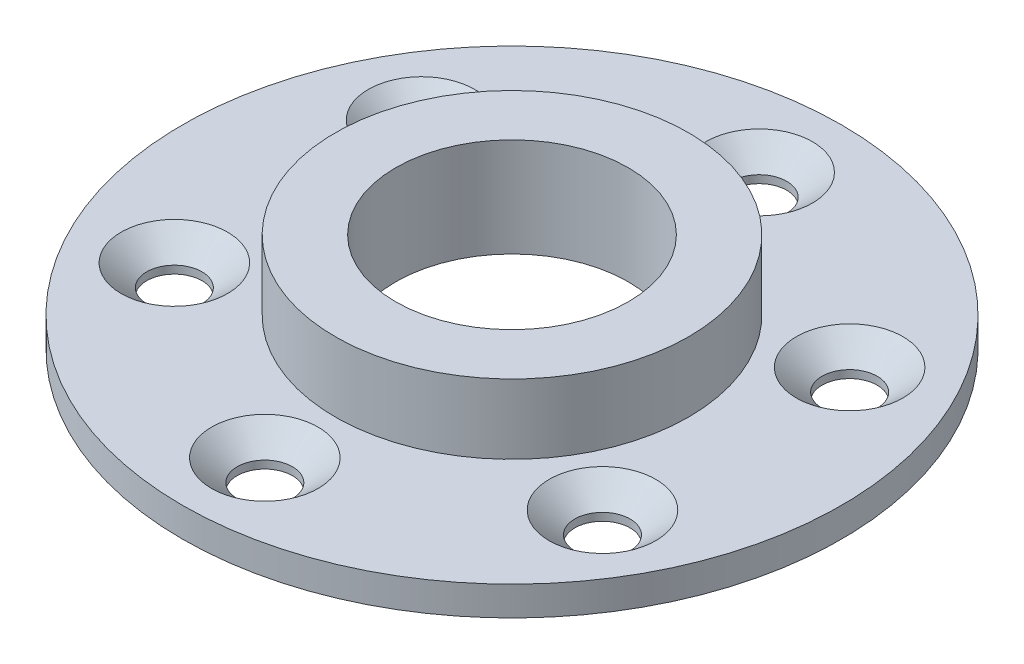
from build123d import *

# Parameters (mm, degrees)
SKETCH5_R           = 90
BOSS_EXTRUDE1_DEPTH = 8
SKETCH6_R           = 48.25
SKETCH6_R_2         = 31.75
EXTRUDE_THIN1_DEPTH = 19
CIRPATTERN1_COUNT   = 6
SKETCH13_W          = 31.75
SKETCH13_H          = 30.969260742


with BuildPart() as part:
    # Sketch5 → Boss-Extrude1 (new body)
    with BuildSketch(Plane(origin=(0, 0, 0), x_dir=(1, 0, 0), z_dir=(0, 1, 0))):
        with Locations(Location((0, 0, 0), (0, 0, 270))):
            Circle(SKETCH5_R)
    extrude(amount=BOSS_EXTRUDE1_DEPTH)

    # Sketch6 → Extrude-Thin1 (add)
    with BuildSketch(Plane(origin=(0, 8, 0), x_dir=(1, 0, 0), z_dir=(0, 1, 0))):
        Circle(SKETCH6_R)
        Circle(SKETCH6_R_2, mode=Mode.SUBTRACT)
    extrude(amount=EXTRUDE_THIN1_DEPTH)

    # Sketch10 → CSK for 9/16 Flat Head Machine Screw (100)1 (revolve, cut)
    with BuildSketch(Plane(origin=(0, 8, -67.5), x_dir=(0, 0, 1), z_dir=(1, 0, 0))):
        Polygon((0, 0), (0, 8), (7.53999, 8), (7.53999, 5.874964459), (14.5415, 0), align=None)
    csk_for_9_16_flat_head_machine_screw_10 = revolve(axis=Axis((0, 14.35, -67.5), (0, -1, 0)), mode=Mode.SUBTRACT)

    # CirPattern1: CSK for 9/16 Flat Head Machine Screw (100)1 ×6 about axis
    cirpattern1_axis = Axis((0, 0, 0), (0, 1, 0))
    for i in range(1, CIRPATTERN1_COUNT):
        add(csk_for_9_16_flat_head_machine_screw_10.rotate(cirpattern1_axis, i * 360 / CIRPATTERN1_COUNT), mode=Mode.SUBTRACT)

    # Sketch13 → Cut-Revolve1 (revolve, cut)
    with BuildSketch(Plane.XY, mode=Mode.PRIVATE) as cut_revolve1_sk:
        with Locations((-15.875, 11.515369629)):
            Rectangle(SKETCH13_W, SKETCH13_H)
    revolve(cut_revolve1_sk.sketch.rotate(Axis((0, 27, 0), (0, -1, 0)), 180), axis=Axis((0, 27, 0), (0, -1, 0)), mode=Mode.SUBTRACT)


solid = part.part
